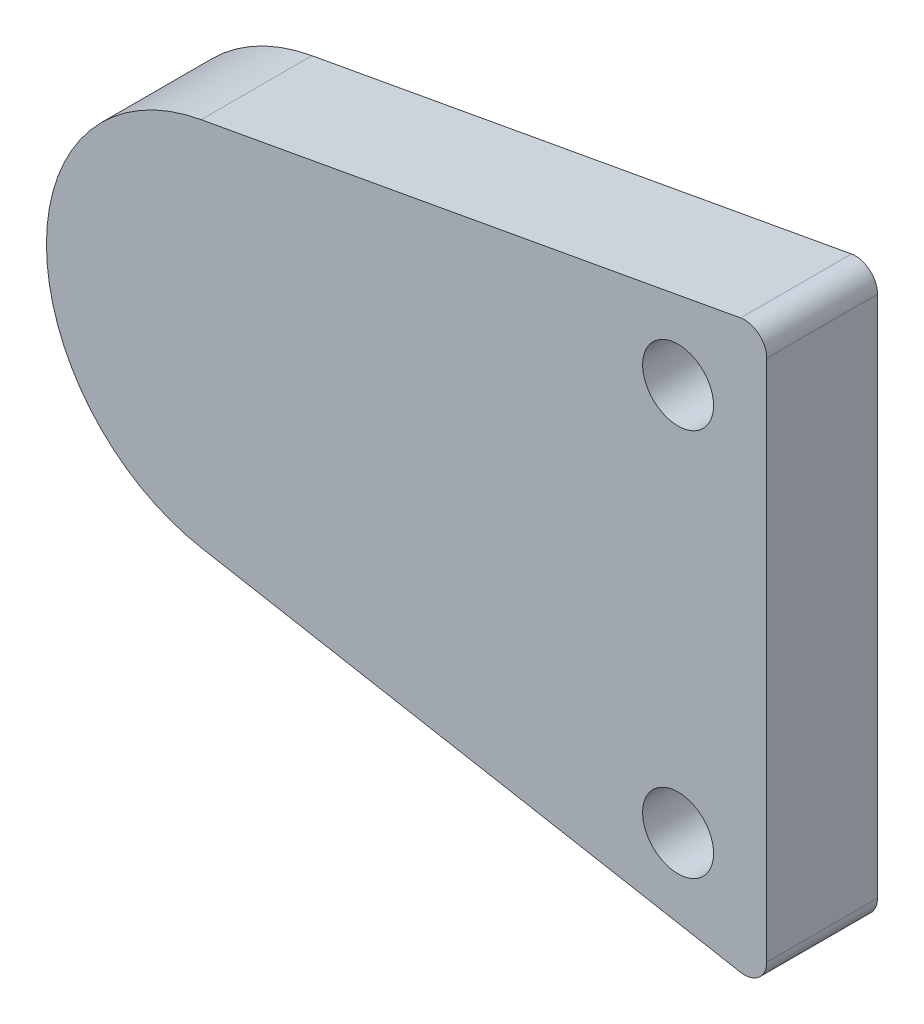
from build123d import *

# Parameters (mm, degrees)
SKETCH_1_R      = 1.6
SKETCH_1_R_2    = 5.5
EXTRUDE_2_DEPTH = 2.5
SKETCH_2_R      = 1.6
EXTRUDE_3_DEPTH = 2.5


with BuildPart() as part:
    # 草图1 → 凸台-拉伸2 (new body)
    with BuildSketch(Plane.XY):
        with BuildLine():
            Line((-1.519577757, 8.363066629), (22.821226146, 12.785815586))
            ThreePointArc((22.821226146, 12.785815586), (23.640790975, 12.569640788), (24, 11.801925394))
            Line((24, 11.801925394), (24, -11.801925394))
            ThreePointArc((24, -11.801925394), (23.640790975, -12.569640788), (22.821226146, -12.785815586))
            Line((22.821226146, -12.785815586), (-1.519577757, -8.363066629))
            ThreePointArc((-1.519577757, -8.363066629), (-8.5, 0), (-1.519577757, 8.363066629))
        make_face()
        with Locations((20, 8.75)):
            Circle(SKETCH_1_R, mode=Mode.SUBTRACT)
        with Locations((20, -8.75)):
            Circle(SKETCH_1_R, mode=Mode.SUBTRACT)
        Circle(SKETCH_1_R_2, mode=Mode.SUBTRACT)
    extrude(amount=EXTRUDE_2_DEPTH)

    # 草图2 → 凸台-拉伸3 (add)
    with BuildSketch(Plane.XY.offset(2.5)):
        with BuildLine():
            Line((-1.519577757, -8.363066629), (22.821226146, -12.785815586))
            ThreePointArc((22.821226146, -12.785815586), (23.640790975, -12.569640788), (24, -11.801925394))
            Line((24, -11.801925394), (24, 11.801925394))
            ThreePointArc((24, 11.801925394), (23.640790975, 12.569640788), (22.821226146, 12.785815586))
            Line((22.821226146, 12.785815586), (-1.519577757, 8.363066629))
            ThreePointArc((-1.519577757, 8.363066629), (-8.5, 0), (-1.519577757, -8.363066629))
        make_face()
        with Locations((20, -8.75)):
            Circle(SKETCH_2_R, mode=Mode.SUBTRACT)
        with Locations((20, 8.75)):
            Circle(SKETCH_2_R, mode=Mode.SUBTRACT)
    extrude(amount=EXTRUDE_3_DEPTH)


solid = part.part
